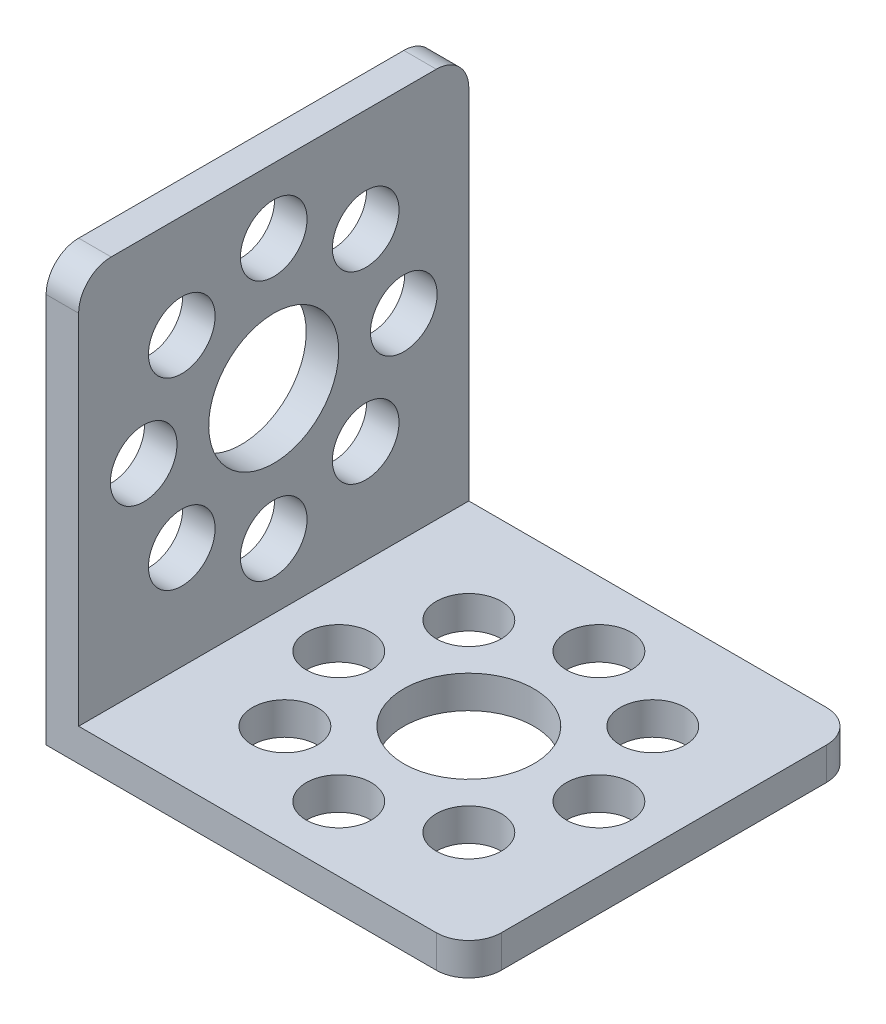
from build123d import *

# Parameters (mm, degrees)
BOSS_EXTRUDE1_DEPTH = 24
SKETCH2_R           = 2.05
SKETCH2_R_2         = 4
CUT_EXTRUDE1_DEPTH  = 43.755116653
SKETCH3_R           = 4
SKETCH3_R_2         = 2
CUT_EXTRUDE2_DEPTH  = 43.755116653
FILLET1_R           = 2


with BuildPart() as part:
    # Sketch1 → Boss-Extrude1 (new body)
    with BuildSketch(Plane.XY):
        Polygon((0, 0), (0, 26), (2, 26), (2, 2), (26, 2), (26, 0), align=None)
    extrude(amount=BOSS_EXTRUDE1_DEPTH)

    # Sketch2 → Cut-Extrude1 (cut, through all)
    with BuildSketch(Plane(origin=(2, 0, 0), x_dir=(0, 0, -1), z_dir=(1, 0, 0))):
        with Locations(Location((-12, 22, 0), (0, 0, 90))):
            Circle(SKETCH2_R)
        with Locations(Location((-12, 14, 0), (0, 0, 90))):
            Circle(SKETCH2_R_2)
        with Locations(Location((-6.343145751, 19.656854249, 0), (0, 0, 90))):
            Circle(SKETCH2_R)
        with Locations(Location((-4, 14, 0), (0, 0, 90))):
            Circle(SKETCH2_R)
        with Locations(Location((-6.343145751, 8.343145751, 0), (0, 0, 90))):
            Circle(SKETCH2_R)
        with Locations(Location((-12, 6, 0), (0, 0, 90))):
            Circle(SKETCH2_R)
        with Locations(Location((-17.656854249, 8.343145751, 0), (0, 0, 90))):
            Circle(SKETCH2_R)
        with Locations(Location((-20, 14, 0), (0, 0, 90))):
            Circle(SKETCH2_R)
        with Locations(Location((-17.656854249, 19.656854249, 0), (0, 0, 90))):
            Circle(SKETCH2_R)
    extrude(amount=-CUT_EXTRUDE1_DEPTH, mode=Mode.SUBTRACT)

    # Sketch3 → Cut-Extrude2 (cut, through all)
    with BuildSketch(Plane(origin=(0, 2, 0), x_dir=(1, 0, 0), z_dir=(0, 1, 0))):
        with Locations(Location((14, -12, 0), (0, 0, 270))):
            Circle(SKETCH3_R)
        with Locations(Location((22, -12, 0), (0, 0, 270))):
            Circle(SKETCH3_R_2)
        with Locations(Location((19.656854249, -17.656854249, 0), (0, 0, 270))):
            Circle(SKETCH3_R_2)
        with Locations(Location((14, -20, 0), (0, 0, 270))):
            Circle(SKETCH3_R_2)
        with Locations(Location((8.343145751, -17.656854249, 0), (0, 0, 270))):
            Circle(SKETCH3_R_2)
        with Locations(Location((6, -12, 0), (0, 0, 270))):
            Circle(SKETCH3_R_2)
        with Locations(Location((8.343145751, -6.343145751, 0), (0, 0, 270))):
            Circle(SKETCH3_R_2)
        with Locations(Location((14, -4, 0), (0, 0, 270))):
            Circle(SKETCH3_R_2)
        with Locations(Location((19.656854249, -6.343145751, 0), (0, 0, 270))):
            Circle(SKETCH3_R_2)
    extrude(amount=-CUT_EXTRUDE2_DEPTH, mode=Mode.SUBTRACT)

    # Fillet1
    fillet1_edges = [part.edges().sort_by_distance(p)[0] for p in [
        (1, 26, 24),
        (1, 26, 0),
        (26, 1, 24),
        (26, 1, 0),
    ]]
    fillet(fillet1_edges, radius=FILLET1_R)


solid = part.part
